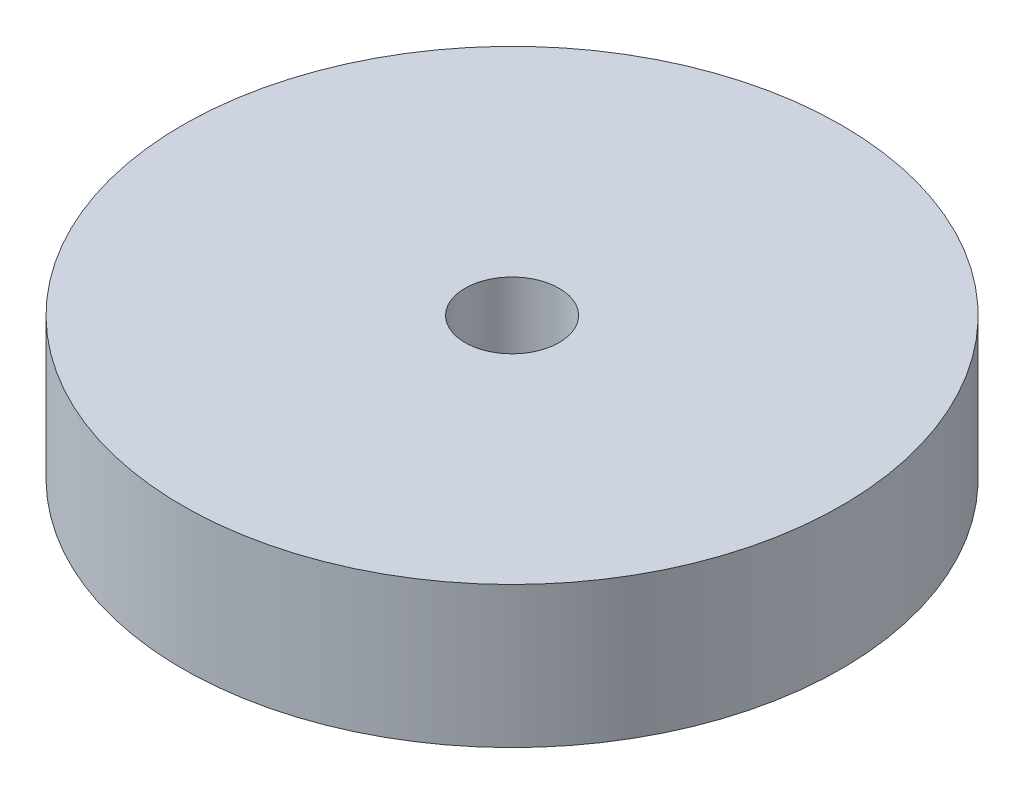
from build123d import *


with BuildPart() as part:
    # Sketch1 → Revolve1 (revolve)
    with BuildSketch(Plane.XY, mode=Mode.PRIVATE) as revolve1_sk:
        Polygon((-14.117321316, 7.519080488), (-11.617321316, 7.519080488), (-11.617321316, 12.519080488), (-26.617321316, 12.519080488), (-26.617321316, 5.019080488), (-21.617321316, 5.019080488), (-21.617321316, 10.019080488), (-14.117321316, 10.019080488), align=None)
    revolve(revolve1_sk.sketch.rotate(Axis((-9.117321316, 12.7, 0), (0, 1, 0)), 270), axis=Axis((-9.117321316, 12.7, 0), (0, 1, 0)))


solid = part.part
